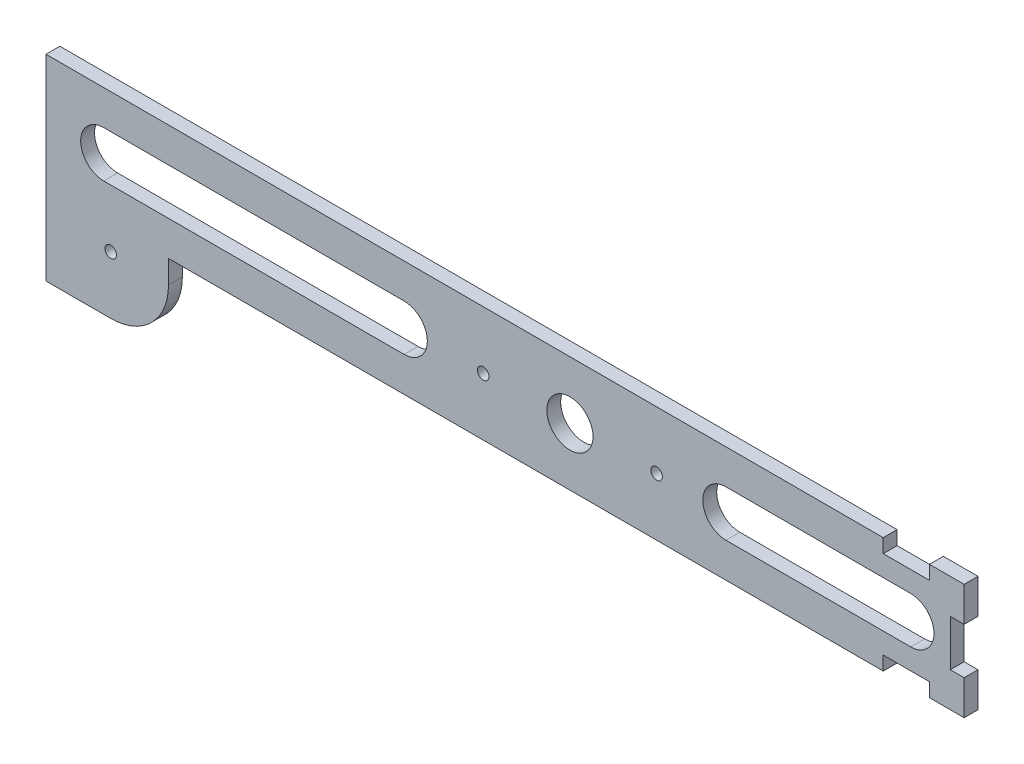
from build123d import *

# Parameters (mm, degrees)
SKETCH1_R           = 2.5
SKETCH1_R_2         = 10
BOSS_EXTRUDE1_DEPTH = 6


with BuildPart() as part:
    # Sketch1 → Boss-Extrude1 (new body)
    with BuildSketch(Plane.XY):
        with BuildLine():
            Line((397.27, -50), (397.27, -35))
            Line((397.27, -35), (391.27, -35))
            Line((391.27, -35), (391.27, -15))
            Line((391.27, -15), (397.27, -15))
            Line((397.27, -15), (397.27, 0))
            Line((397.27, 0), (382.27, 0))
            Line((382.27, 0), (382.27, -6))
            Line((382.27, -6), (362.27, -6))
            Line((362.27, -6), (362.27, 0))
            Line((362.27, 0), (0, 0))
            Line((0, 0), (0, -85))
            Line((0, -85), (28, -85))
            ThreePointArc((28, -85), (45.67766953, -77.67766953), (53, -60))
            Line((53, -60), (53, -50))
            Line((53, -50), (362.27, -50))
            Line((362.27, -50), (362.27, -44))
            Line((362.27, -44), (382.27, -44))
            Line((382.27, -44), (382.27, -50))
            Line((382.27, -50), (397.27, -50))
        make_face()
        with Locations((189.2, -25)):
            Circle(SKETCH1_R, mode=Mode.SUBTRACT)
        with Locations((226.7, -25)):
            Circle(SKETCH1_R_2, mode=Mode.SUBTRACT)
        with Locations((28, -60)):
            Circle(SKETCH1_R, mode=Mode.SUBTRACT)
        with Locations((264.2, -25)):
            Circle(SKETCH1_R, mode=Mode.SUBTRACT)
        with BuildLine():
            Line((25, -35), (155, -35))
            ThreePointArc((155, -35), (165, -25), (155, -15))
            Line((155, -15), (25, -15))
            ThreePointArc((25, -15), (15, -25), (25, -35))
        make_face(mode=Mode.SUBTRACT)
        with BuildLine():
            Line((294.2, -35), (374.2, -35))
            ThreePointArc((374.2, -35), (384.2, -25), (374.2, -15))
            Line((374.2, -15), (294.2, -15))
            ThreePointArc((294.2, -15), (284.2, -25), (294.2, -35))
        make_face(mode=Mode.SUBTRACT)
    extrude(amount=BOSS_EXTRUDE1_DEPTH)


solid = part.part
